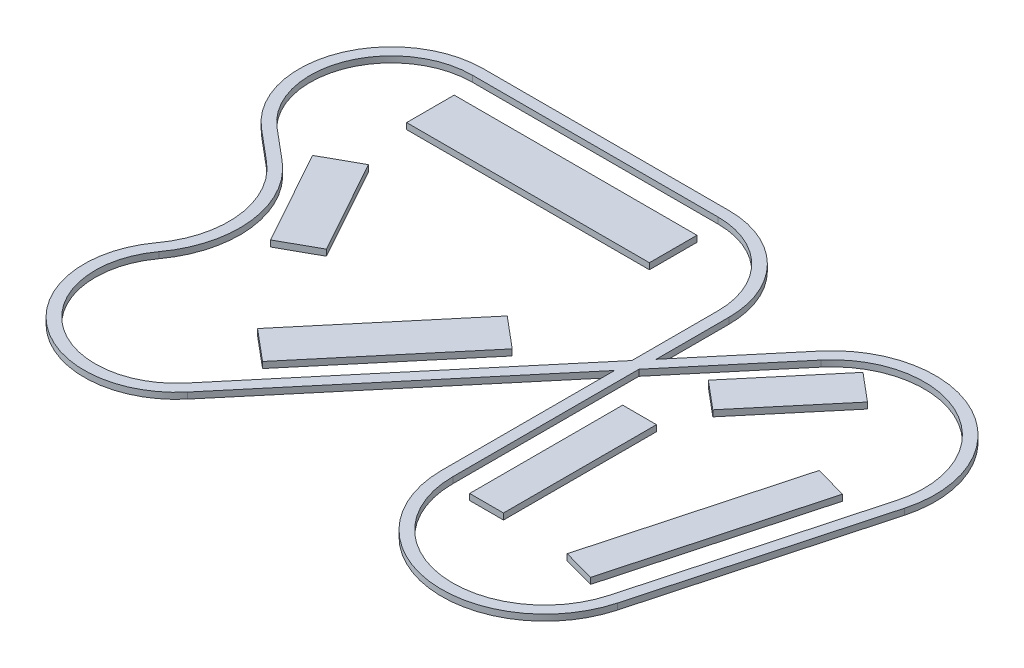
from build123d import *

# Parameters (mm, degrees)
BOSS_EXTRUDE1_DEPTH   = 10
BOSS_EXTRUDE4_DEPTH   = 10
CUT_EXTRUDE1_DEPTH    = 875.441536067
BOSS_EXTRUDE5_DEPTH   = 10
SKETCH7_W             = 395.169169126
SKETCH7_H             = 77.42054027
BOSS_EXTRUDE5_2_DEPTH = 10
BOSS_EXTRUDE5_3_DEPTH = 10
SKETCH7_W_2           = 55.067842443
SKETCH7_H_2           = 249.05025975
BOSS_EXTRUDE5_4_DEPTH = 10
BOSS_EXTRUDE5_5_DEPTH = 10
BOSS_EXTRUDE5_6_DEPTH = 10


with BuildPart() as part:
    # Sketch4 → Boss-Extrude1 (new body)
    with BuildSketch(Plane(origin=(0, 0, 0), x_dir=(1, 0, 0), z_dir=(0, 1, 0))):
        with BuildLine():
            Line((350, 200), (350, 52.930542638))
            Line((350, 52.930542638), (14.906666468, -346.418141453))
            ThreePointArc((14.906666468, -346.418141453), (-192.619131059, -367.990239265), (-220.948265722, -161.2784298))
            ThreePointArc((-220.948265722, -161.2784298), (-192.973217507, -54.616776941), (-245.478389991, 42.349806868))
            Line((-245.478389991, 42.349806868), (-296.418141453, 85.093333532))
            ThreePointArc((-296.418141453, 85.093333532), (-340.953893118, 251.303021499), (-200, 350))
            Line((-200, 350), (200, 350))
            ThreePointArc((200, 350), (306.066017178, 306.066017178), (350, 200))
        make_face()
        with BuildLine():
            Line((1.117866492, -334.847964479), (332, 59.482006855))
            Line((332, 59.482006855), (332, 200))
            ThreePointArc((332, 200), (293.338095117, 293.338095117), (200, 332))
            Line((200, 332), (-200, 332))
            ThreePointArc((-200, 332), (-324.039425944, 245.146658919), (-284.847964479, 98.882133508))
            Line((-284.847964479, 98.882133508), (-233.908213017, 56.138606845))
            ThreePointArc((-233.908213017, 56.138606845), (-175.102419834, -52.463967022), (-206.434473835, -171.925018224))
            ThreePointArc((-206.434473835, -171.925018224), (-181.504835332, -353.831410553), (1.117866492, -334.847964479))
        make_face(mode=Mode.SUBTRACT)
    extrude(amount=BOSS_EXTRUDE1_DEPTH)

    # Sketch5 → Boss-Extrude4 (add)
    with BuildSketch(Plane(origin=(0, 0, 0), x_dir=(1, 0, 0), z_dir=(0, 1, 0))):
        with BuildLine():
            Line((762.106058652, 73.40111888), (662.106058652, -294.109247878))
            ThreePointArc((662.106058652, -294.109247878), (477.749357914, -416.519995576), (332, -250))
            Line((332, -250), (332, 31.478977972))
            Line((332, 31.478977972), (350, 52.930542638))
            Line((350, 52.930542638), (350, 80.933571522))
            Line((350, 80.933571522), (471.304533556, 225.498685185))
            ThreePointArc((471.304533556, 225.498685185), (677.86195693, 266.377810019), (762.106058652, 73.40111888))
        make_face()
    extrude(amount=BOSS_EXTRUDE4_DEPTH)

    # Sketch6 → Cut-Extrude1 (cut, through all)
    with BuildSketch(Plane(origin=(0, 0, 0), x_dir=(1, 0, 0), z_dir=(0, 1, 0))):
        with BuildLine():
            Line((744.737552368, 78.127109724), (644.737552368, -289.383257034))
            ThreePointArc((644.737552368, -289.383257034), (480.13335528, -398.678567479), (350, -250))
            Line((350, -250), (350, 52.930542638))
            Line((350, 52.930542638), (485.093333532, 213.928508211))
            ThreePointArc((485.093333532, 213.928508211), (669.519604402, 250.427726812), (744.737552368, 78.127109724))
        make_face()
    extrude(amount=CUT_EXTRUDE1_DEPTH, mode=Mode.SUBTRACT)


with BuildPart() as body_2:
    # Sketch7 → Boss-Extrude5 (new body)
    with BuildSketch(Plane(origin=(0, 0, 0), x_dir=(1, 0, 0), z_dir=(0, 1, 0))):
        Polygon((32.748032026, -242.409656931), (218.180421735, -21.419940312), (167.694190818, 20.94303743), (-17.738198891, -200.046679189), align=None)
    extrude(amount=BOSS_EXTRUDE5_DEPTH)


with BuildPart() as body_3:
    # Sketch7 → Boss-Extrude5 2 (new body)
    with BuildSketch(Plane(origin=(0, 0, 0), x_dir=(1, 0, 0), z_dir=(0, 1, 0))):
        with Locations((10.81485439, 250.391573314)):
            Rectangle(SKETCH7_W, SKETCH7_H)
    extrude(amount=BOSS_EXTRUDE5_2_DEPTH)


with BuildPart() as body_4:
    # Sketch7 → Boss-Extrude5 3 (new body)
    with BuildSketch(Plane(origin=(0, 0, 0), x_dir=(1, 0, 0), z_dir=(0, 1, 0))):
        Polygon((604.078060814, -279.646065012), (691.774991352, 42.649246046), (639.404124107, 56.899420187), (551.707193568, -265.395890872), align=None)
    extrude(amount=BOSS_EXTRUDE5_3_DEPTH)


with BuildPart() as body_5:
    # Sketch7 → Boss-Extrude5 4 (new body)
    with BuildSketch(Plane(origin=(0, 0, 0), x_dir=(1, 0, 0), z_dir=(0, 1, 0))):
        with Locations((414.900552271, -135.362490407)):
            Rectangle(SKETCH7_W_2, SKETCH7_H_2)
    extrude(amount=BOSS_EXTRUDE5_4_DEPTH)


with BuildPart() as body_6:
    # Sketch7 → Boss-Extrude5 5 (new body)
    with BuildSketch(Plane(origin=(0, 0, 0), x_dir=(1, 0, 0), z_dir=(0, 1, 0))):
        Polygon((-216.980596567, 88.855111246), (-132.16915587, -64.530345215), (-73.612877021, -32.152814218), (-158.424317717, 121.232642243), align=None)
    extrude(amount=BOSS_EXTRUDE5_5_DEPTH)


with BuildPart() as body_7:
    # Sketch7 → Boss-Extrude5 6 (new body)
    with BuildSketch(Plane(origin=(0, 0, 0), x_dir=(1, 0, 0), z_dir=(0, 1, 0))):
        Polygon((536.780734207, 230.939292617), (421.92884631, 94.064142599), (467.356573726, 55.94575328), (582.208461623, 192.820903297), align=None)
    extrude(amount=BOSS_EXTRUDE5_6_DEPTH)


solid = Compound([part.part, body_2.part, body_3.part, body_4.part, body_5.part, body_6.part, body_7.part])
